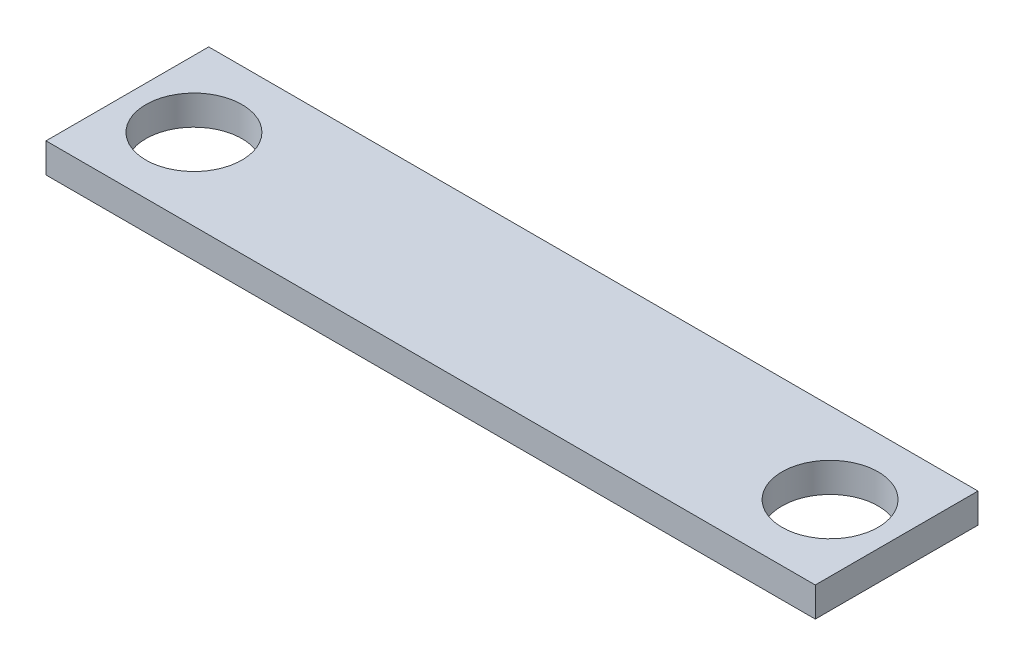
from build123d import *

# Parameters (mm, degrees)
SKETCH_1_W      = 520
SKETCH_1_H      = 110
SKETCH_1_R      = 32.5
EXTRUDE_1_DEPTH = 20


with BuildPart() as part:
    # 草图1 → 凸台-拉伸1 (new body)
    with BuildSketch(Plane(origin=(0, 0, 0), x_dir=(1, 0, 0), z_dir=(0, 1, 0))):
        Rectangle(SKETCH_1_W, SKETCH_1_H)
        with Locations(Location((-215, 0, 0), (0, 0, 270))):
            Circle(SKETCH_1_R, mode=Mode.SUBTRACT)
        with Locations(Location((215, 0, 0), (0, 0, 270))):
            Circle(SKETCH_1_R, mode=Mode.SUBTRACT)
    extrude(amount=EXTRUDE_1_DEPTH)


solid = part.part
